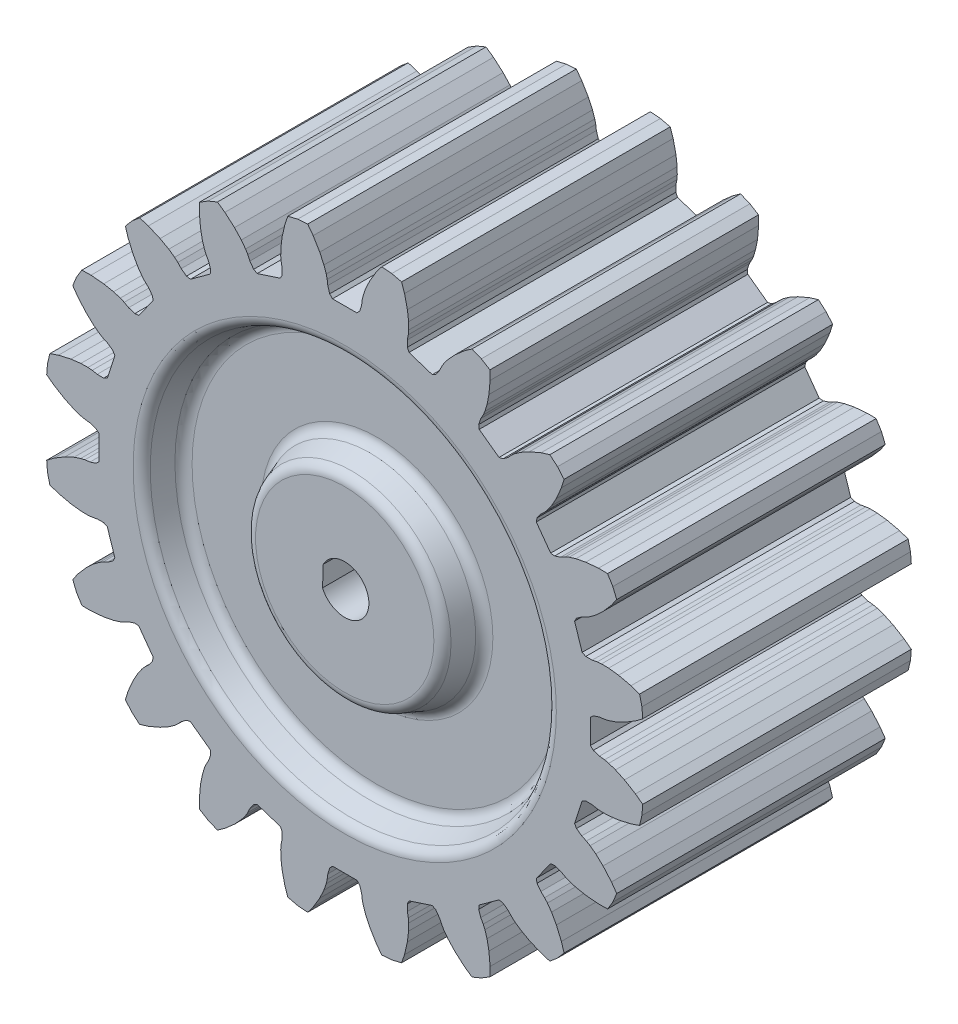
from build123d import *

# Parameters (mm, degrees)
ESBO_O1_R                   = 5
RESSALTO_EXTRUS_O1_DEPTH    = 12.5
ESBO_O2_R                   = 19
ESBO_O2_R_2                 = 9
CORTE_EXTRUS_O1_DEPTH       = 3
CORTE_EXTRUS_O1_DRAFT       = -20
ESPELHAR1_COPY_1_SKETCH_R   = 19
ESPELHAR1_COPY_1_SKETCH_R_2 = 9
ESPELHAR1_COPY_1_DEPTH      = 3
ESPELHAR1_COPY_1_DRAFT      = -20
FILETE1_R                   = 1
ESBO_O3_W                   = 2.987864728
ESBO_O3_H                   = 6.5
CORTE_EXTRUS_O2_DEPTH       = 11.5
SKETCH1_R                   = 6.006277081
BOSS_EXTRUDE1_DEPTH         = 25


with BuildPart() as part:
    # Esboço1 → Ressalto-extrusão1 (new, symmetric)
    with BuildSketch(Plane.XY):
        Polygon((-1.982307072, 5.295406607), (-2.201613874, 4.381928035), (-2.275321114, 3.445388758), (-1.598661738, 2.937676012), (-0.575901873, 2.326009933), (0.265272597, 1.935875873), (0.892383046, 1.721391467), (1.280666419, 1.632593063), (1.750625054, 1.575873938), (2.323999986, 1.393988061), (2.596479089, 1.138556294), (2.596479089, -1.138556294), (2.323999986, -1.393988061), (1.750625054, -1.575873938), (1.280666419, -1.632593063), (0.892383046, -1.721391467), (0.265272597, -1.935875873), (-0.575901873, -2.326009933), (-1.598661738, -2.937676012), (-2.275321114, -3.445388758), (-2.201613874, -4.381928035), (-1.982307072, -5.295406607), (-1.181873897, -5.569170876), (-0.02015625, -5.834849707), (0.900406267, -5.945952041), (1.563103072, -5.956151046), (1.95982272, -5.920617186), (2.424307116, -5.829335075), (3.025824908, -5.825136225), (3.363900692, -5.983865598), (4.06756718, -8.149528363), (3.887356909, -8.476659083), (3.398250771, -8.826825429), (2.968820723, -9.025993728), (2.626981507, -9.23043219), (2.096843354, -9.628206767), (1.417396947, -10.259183514), (0.633709726, -11.156962704), (0.147060285, -11.848925466), (0.506566588, -12.716850458), (0.997420154, -13.517850678), (1.843275152, -13.530868516), (3.030233565, -13.424553604), (3.940073054, -13.24574874), (4.573486835, -13.050663996), (4.939809074, -12.894276173), (5.353352262, -12.663928155), (5.924132162, -12.474055592), (6.294711413, -12.520545033), (7.63316461, -14.362767815), (7.56286341, -14.729575654), (7.205903182, -15.213745748), (6.859037325, -15.53586724), (6.59710387, -15.835933897), (6.21583163, -16.3780617), (5.764622235, -17.188116733), (5.296720424, -18.284128151), (5.047717555, -19.092606793), (5.657831939, -19.806958955), (6.372184102, -20.41707334), (7.180662743, -20.168070471), (8.276674161, -19.700168659), (9.086729195, -19.248959264), (9.628856997, -18.867687024), (9.928923655, -18.605753569), (10.251045147, -18.258887712), (10.735215241, -17.901927485), (11.10202308, -17.831626285), (12.944245862, -19.170079482), (12.990735303, -19.540658732), (12.80086274, -20.111438632), (12.570514721, -20.52498182), (12.414126899, -20.89130406), (12.219042155, -21.524717841), (12.040237291, -22.43455733), (11.933922379, -23.621515742), (11.946940217, -24.467370741), (12.747940436, -24.958224307), (13.615865429, -25.31773061), (14.307828191, -24.831081168), (15.20560738, -24.047393948), (15.836584127, -23.367947541), (16.234358705, -22.837809388), (16.438797166, -22.495970172), (16.637965465, -22.066540123), (16.988131812, -21.577433985), (17.315262532, -21.397223715), (19.480925297, -22.100890203), (19.639654669, -22.438965987), (19.63545582, -23.040483779), (19.544173709, -23.504968175), (19.508639849, -23.901687823), (19.518838854, -24.564384628), (19.629941188, -25.484947144), (19.895620019, -26.646664792), (20.169384288, -27.447097967), (21.08286286, -27.666404769), (22.019402137, -27.740112008), (22.527114883, -27.063452633), (23.138780962, -26.040692768), (23.528915022, -25.199518297), (23.743399428, -24.572407848), (23.832197831, -24.184124476), (23.888916957, -23.71416584), (24.070802834, -23.140790909), (24.326234601, -22.868311805), (26.603347189, -22.868311805), (26.858778955, -23.140790909), (27.040664832, -23.71416584), (27.097383958, -24.184124476), (27.186182362, -24.572407848), (27.400666767, -25.199518297), (27.790800828, -26.040692768), (28.402466907, -27.063452633), (28.910179653, -27.740112008), (29.84671893, -27.666404769), (30.760197502, -27.447097967), (31.033961771, -26.646664792), (31.299640602, -25.484947144), (31.410742935, -24.564384628), (31.420941941, -23.901687823), (31.38540808, -23.504968175), (31.29412597, -23.040483779), (31.28992712, -22.438965987), (31.448656493, -22.100890203), (33.614319258, -21.397223715), (33.941449977, -21.577433985), (34.291616324, -22.066540123), (34.490784623, -22.495970172), (34.695223084, -22.837809388), (35.092997662, -23.367947541), (35.723974409, -24.047393948), (36.621753599, -24.831081168), (37.313716361, -25.31773061), (38.181641353, -24.958224307), (38.982641573, -24.467370741), (38.995659411, -23.621515742), (38.889344499, -22.43455733), (38.710539635, -21.524717841), (38.515454891, -20.89130406), (38.359067068, -20.52498182), (38.12871905, -20.111438632), (37.938846486, -19.540658732), (37.985335928, -19.170079482), (39.82755871, -17.831626285), (40.194366548, -17.901927485), (40.678536643, -18.258887712), (41.000658134, -18.605753569), (41.300724792, -18.867687024), (41.842852595, -19.248959264), (42.652907628, -19.700168659), (43.748919046, -20.168070471), (44.557397688, -20.41707334), (45.27174985, -19.806958955), (45.881864235, -19.092606793), (45.632861365, -18.284128151), (45.164959554, -17.188116733), (44.713750159, -16.3780617), (44.332477919, -15.835933897), (44.070544464, -15.53586724), (43.723678607, -15.213745748), (43.366718379, -14.729575654), (43.296417179, -14.362767815), (44.634870376, -12.520545033), (45.005449627, -12.474055592), (45.576229527, -12.663928155), (45.989772715, -12.894276173), (46.356094954, -13.050663996), (46.989508735, -13.24574874), (47.899348225, -13.424553604), (49.086306637, -13.530868516), (49.932161636, -13.517850678), (50.423015201, -12.716850458), (50.782521504, -11.848925466), (50.295872063, -11.156962704), (49.512184842, -10.259183514), (48.832738435, -9.628206767), (48.302600283, -9.23043219), (47.960761067, -9.025993728), (47.531331018, -8.826825429), (47.04222488, -8.476659083), (46.86201461, -8.149528363), (47.565681098, -5.983865598), (47.903756882, -5.825136225), (48.505274673, -5.829335075), (48.96975907, -5.920617186), (49.366478717, -5.956151046), (50.029175523, -5.945952041), (50.949738039, -5.834849707), (52.111455686, -5.569170876), (52.911888861, -5.295406607), (53.131195663, -4.381928035), (53.204902903, -3.445388758), (52.528243528, -2.937676012), (51.505483663, -2.326009933), (50.664309192, -1.935875873), (50.037198743, -1.721391467), (49.64891537, -1.632593063), (49.178956735, -1.575873938), (48.605581804, -1.393988061), (48.3331027, -1.138556294), (48.3331027, 1.138556294), (48.605581804, 1.393988061), (49.178956735, 1.575873938), (49.64891537, 1.632593063), (50.037198743, 1.721391467), (50.664309192, 1.935875873), (51.505483663, 2.326009933), (52.528243528, 2.937676012), (53.204902903, 3.445388758), (53.131195663, 4.381928035), (52.911888861, 5.295406607), (52.111455686, 5.569170876), (50.949738039, 5.834849707), (50.029175523, 5.945952041), (49.366478717, 5.956151046), (48.96975907, 5.920617186), (48.505274673, 5.829335075), (47.903756882, 5.825136225), (47.565681098, 5.983865598), (46.86201461, 8.149528363), (47.04222488, 8.476659083), (47.531331018, 8.826825429), (47.960761067, 9.025993728), (48.302600283, 9.23043219), (48.832738435, 9.628206767), (49.512184842, 10.259183514), (50.295872063, 11.156962704), (50.782521504, 11.848925466), (50.423015201, 12.716850458), (49.932161636, 13.517850678), (49.086306637, 13.530868516), (47.899348225, 13.424553604), (46.989508735, 13.24574874), (46.356094954, 13.050663996), (45.989772715, 12.894276173), (45.576229527, 12.663928155), (45.005449627, 12.474055592), (44.634870376, 12.520545033), (43.296417179, 14.362767815), (43.366718379, 14.729575654), (43.723678607, 15.213745748), (44.070544464, 15.53586724), (44.332477919, 15.835933897), (44.713750159, 16.3780617), (45.164959554, 17.188116733), (45.632861365, 18.284128151), (45.881864235, 19.092606793), (45.27174985, 19.806958955), (44.557397688, 20.41707334), (43.748919046, 20.168070471), (42.652907628, 19.700168659), (41.842852595, 19.248959264), (41.300724792, 18.867687024), (41.000658134, 18.605753569), (40.678536643, 18.258887712), (40.194366548, 17.901927485), (39.82755871, 17.831626285), (37.985335928, 19.170079482), (37.938846486, 19.540658732), (38.12871905, 20.111438632), (38.359067068, 20.52498182), (38.515454891, 20.89130406), (38.710539635, 21.524717841), (38.889344499, 22.43455733), (38.995659411, 23.621515742), (38.982641573, 24.467370741), (38.181641353, 24.958224307), (37.313716361, 25.31773061), (36.621753599, 24.831081168), (35.723974409, 24.047393948), (35.092997662, 23.367947541), (34.695223084, 22.837809388), (34.490784623, 22.495970172), (34.291616324, 22.066540123), (33.941449977, 21.577433985), (33.614319258, 21.397223715), (31.448656493, 22.100890203), (31.28992712, 22.438965987), (31.29412597, 23.040483779), (31.38540808, 23.504968175), (31.420941941, 23.901687823), (31.410742935, 24.564384628), (31.299640602, 25.484947144), (31.033961771, 26.646664792), (30.760197502, 27.447097967), (29.84671893, 27.666404769), (28.910179653, 27.740112008), (28.402466907, 27.063452633), (27.790800828, 26.040692768), (27.400666767, 25.199518297), (27.186182362, 24.572407848), (27.097383958, 24.184124476), (27.040664832, 23.71416584), (26.858778955, 23.140790909), (26.603347189, 22.868311805), (24.326234601, 22.868311805), (24.070802834, 23.140790909), (23.888916957, 23.71416584), (23.832197831, 24.184124476), (23.743399428, 24.572407848), (23.528915022, 25.199518297), (23.138780962, 26.040692768), (22.527114883, 27.063452633), (22.019402137, 27.740112008), (21.08286286, 27.666404769), (20.169384288, 27.447097967), (19.895620019, 26.646664792), (19.629941188, 25.484947144), (19.518838854, 24.564384628), (19.508639849, 23.901687823), (19.544173709, 23.504968175), (19.63545582, 23.040483779), (19.639654669, 22.438965987), (19.480925297, 22.100890203), (17.315262532, 21.397223715), (16.988131812, 21.577433985), (16.637965465, 22.066540123), (16.438797166, 22.495970172), (16.234358705, 22.837809388), (15.836584127, 23.367947541), (15.20560738, 24.047393948), (14.307828191, 24.831081168), (13.615865429, 25.31773061), (12.747940436, 24.958224307), (11.946940217, 24.467370741), (11.933922379, 23.621515742), (12.040237291, 22.43455733), (12.219042155, 21.524717841), (12.414126899, 20.89130406), (12.570514721, 20.52498182), (12.80086274, 20.111438632), (12.990735303, 19.540658732), (12.944245862, 19.170079482), (11.10202308, 17.831626285), (10.735215241, 17.901927485), (10.251045147, 18.258887712), (9.928923655, 18.605753569), (9.628856997, 18.867687024), (9.086729195, 19.248959264), (8.276674161, 19.700168659), (7.180662743, 20.168070471), (6.372184102, 20.41707334), (5.657831939, 19.806958955), (5.047717555, 19.092606793), (5.296720424, 18.284128151), (5.764622235, 17.188116733), (6.21583163, 16.3780617), (6.59710387, 15.835933897), (6.859037325, 15.53586724), (7.205903182, 15.213745748), (7.56286341, 14.729575654), (7.63316461, 14.362767815), (6.294711413, 12.520545033), (5.924132162, 12.474055592), (5.353352262, 12.663928155), (4.939809074, 12.894276173), (4.573486835, 13.050663996), (3.940073054, 13.24574874), (3.030233565, 13.424553604), (1.843275152, 13.530868516), (0.997420154, 13.517850678), (0.506566588, 12.716850458), (0.147060285, 11.848925466), (0.633709726, 11.156962704), (1.417396947, 10.259183514), (2.096843354, 9.628206767), (2.626981507, 9.23043219), (2.968820723, 9.025993728), (3.398250771, 8.826825429), (3.887356909, 8.476659083), (4.06756718, 8.149528363), (3.363900692, 5.983865598), (3.025824908, 5.825136225), (2.424307116, 5.829335075), (1.95982272, 5.920617186), (1.563103072, 5.956151046), (0.900406267, 5.945952041), (-0.02015625, 5.834849707), (-1.181873897, 5.569170876), align=None)
        with Locations((25.464790895, 0)):
            Circle(ESBO_O1_R, mode=Mode.SUBTRACT)
    extrude(amount=RESSALTO_EXTRUS_O1_DEPTH, both=True)


with BuildPart() as corte_extrus_o1_tool:
    # Esboço2 → Corte-extrusão1 (with draft: the straight prism first)
    with BuildSketch(Plane.XY.offset(12.5)):
        with Locations((25.464790895, 0)):
            Circle(ESBO_O2_R)
        with Locations((25.464790895, 0)):
            Circle(ESBO_O2_R_2, mode=Mode.SUBTRACT)
    extrude(amount=-CORTE_EXTRUS_O1_DEPTH)
    # Corte-extrusão1: the draft: its side faces are tilted about the plane it starts from
    corte_extrus_o1_sides = [corte_extrus_o1_tool.faces().sort_by_distance(p)[0] for p in [
        (6.464790895, 0, 11),
        (16.464790895, 0, 11),
    ]]
    draft(corte_extrus_o1_sides, Plane.XY.offset(12.5), CORTE_EXTRUS_O1_DRAFT)


with BuildPart() as part_1:
    add(part.part)

    # Corte-extrusão1: cut by corte_extrus_o1_tool
    add(corte_extrus_o1_tool.part, mode=Mode.SUBTRACT)


with BuildPart() as espelhar1_copy_1_tool:
    # Espelhar1 copy 1 sketch → Espelhar1 copy 1 (with draft: the straight prism first)
    with BuildSketch(Plane(origin=(0, 0, -12.5), x_dir=(1, 0, 0), z_dir=(0, 0, -1))):
        with Locations((25.464790895, 0)):
            Circle(ESPELHAR1_COPY_1_SKETCH_R)
        with Locations((25.464790895, 0)):
            Circle(ESPELHAR1_COPY_1_SKETCH_R_2, mode=Mode.SUBTRACT)
    extrude(amount=-ESPELHAR1_COPY_1_DEPTH)
    # Espelhar1 copy 1: the draft: its side faces are tilted about the plane it starts from
    espelhar1_copy_1_sides = [espelhar1_copy_1_tool.faces().sort_by_distance(p)[0] for p in [
        (6.464790895, 0, -11),
        (16.464790895, 0, -11),
    ]]
    draft(espelhar1_copy_1_sides, Plane(origin=(0, 0, -12.5), x_dir=(1, 0, 0), z_dir=(0, 0, -1)), ESPELHAR1_COPY_1_DRAFT)


with BuildPart() as part_2:
    add(part_1.part)

    # Espelhar1 copy 1: cut by espelhar1_copy_1_tool
    add(espelhar1_copy_1_tool.part, mode=Mode.SUBTRACT)

    # Filete1
    filete1_edges = [part_2.edges().sort_by_distance(p)[0] for p in [
        (7.556701598, 0, 9.5),
        (15.372880192, 0, 9.5),
        (6.464790895, 0, 12.5),
        (16.464790895, 0, 12.5),
        (7.556701598, 0, -9.5),
        (16.464790895, 0, -12.5),
        (6.464790895, 0, -12.5),
        (15.372880192, 0, -9.5),
    ]]
    fillet(filete1_edges, radius=FILETE1_R)

    # Esboço3 → Corte-extrusão2 (cut, symmetric)
    with BuildSketch(Plane.XY):
        with Locations((25.464790895, 3.25)):
            Rectangle(ESBO_O3_W, ESBO_O3_H)
    extrude(amount=CORTE_EXTRUS_O2_DEPTH, both=True, mode=Mode.SUBTRACT)

    # Sketch1 → Boss-Extrude1 (add)
    with BuildSketch(Plane(origin=(0, 0, -12.5), x_dir=(-1, 0, 0), z_dir=(0, 0, -1))):
        with Locations((-25.464790895, 0)):
            Circle(SKETCH1_R)
        with BuildLine():
            Line((-23.401725653, -0.897920826), (-23.46611287, 1.033337387))
            ThreePointArc((-23.46611287, 1.033337387), (-27.713541472, -0.074972259), (-23.401725653, -0.897920826))
        make_face(mode=Mode.SUBTRACT)
    extrude(amount=-BOSS_EXTRUDE1_DEPTH)


solid = part_2.part
